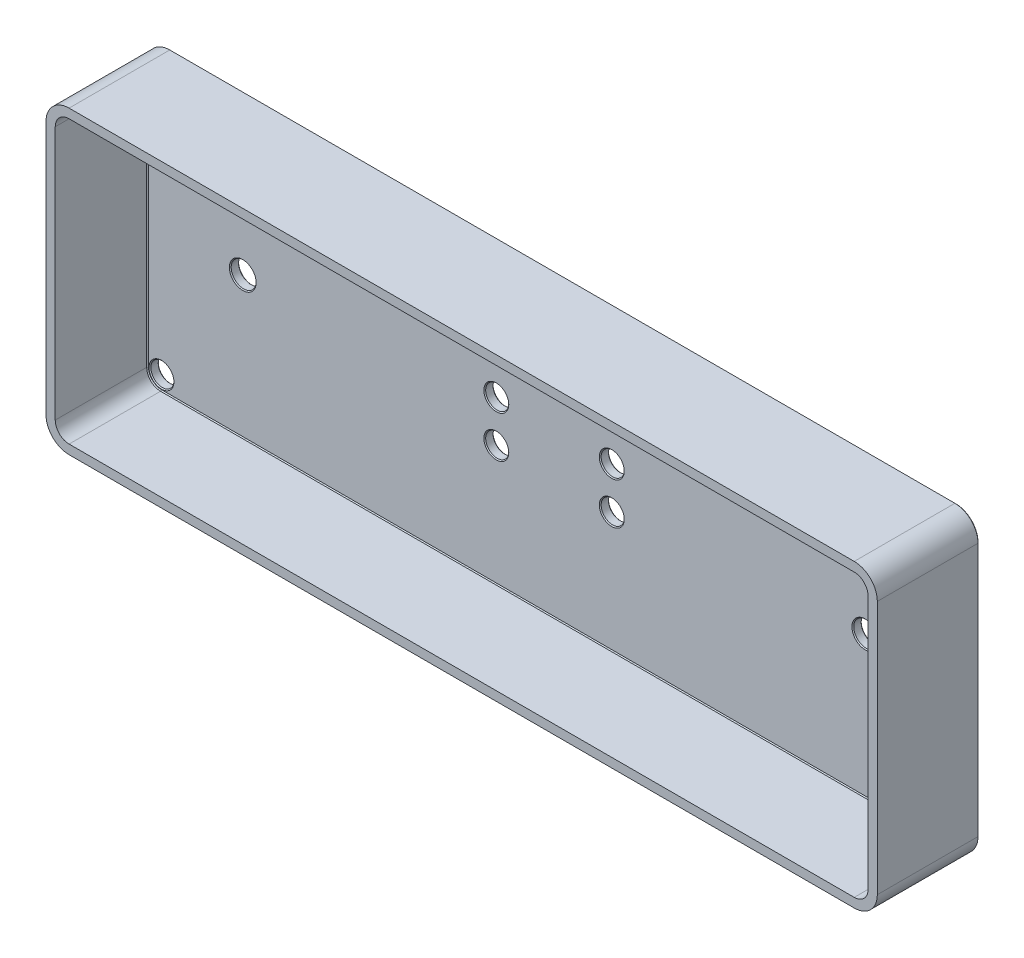
from build123d import *

# Parameters (mm, degrees)
SKETCH3_R           = 3.175
SKETCH3_R_2         = 3.429
BOSS_EXTRUDE1_DEPTH = 27.94
CUT_EXTRUDE1_DEPTH  = 25.4
CHAMFER1_SIZE       = 0.254
CHAMFER2_SIZE       = 0.254


with BuildPart() as part:
    # Sketch3 → Boss-Extrude1 (new body)
    with BuildSketch(Plane.XY):
        with BuildLine():
            Line((107.95, -41.275), (-107.95, -41.275))
            ThreePointArc((-107.95, -41.275), (-112.440128061, -39.415128061), (-114.3, -34.925))
            Line((-114.3, -34.925), (-114.3, 34.925))
            ThreePointArc((-114.3, 34.925), (-112.440128061, 39.415128061), (-107.95, 41.275))
            Line((-107.95, 41.275), (107.95, 41.275))
            ThreePointArc((107.95, 41.275), (112.440128061, 39.415128061), (114.3, 34.925))
            Line((114.3, 34.925), (114.3, -34.925))
            ThreePointArc((114.3, -34.925), (112.440128061, -39.415128061), (107.95, -41.275))
        make_face()
        with Locations((-107.95, 34.925)):
            Circle(SKETCH3_R, mode=Mode.SUBTRACT)
        with Locations((-107.95, -34.925)):
            Circle(SKETCH3_R, mode=Mode.SUBTRACT)
        with Locations((107.95, -34.925)):
            Circle(SKETCH3_R, mode=Mode.SUBTRACT)
        with Locations((107.95, 34.925)):
            Circle(SKETCH3_R, mode=Mode.SUBTRACT)
        with Locations((-85.598, 0)):
            Circle(SKETCH3_R_2, mode=Mode.SUBTRACT)
        with Locations((85.598, 0)):
            Circle(SKETCH3_R_2, mode=Mode.SUBTRACT)
        with Locations((-15.875, 5.732638889)):
            Circle(SKETCH3_R, mode=Mode.SUBTRACT)
        with Locations((15.875, 5.732638889)):
            Circle(SKETCH3_R, mode=Mode.SUBTRACT)
        with Locations((15.875, -5.732638889)):
            Circle(SKETCH3_R, mode=Mode.SUBTRACT)
        with Locations((-15.875, -5.732638889)):
            Circle(SKETCH3_R, mode=Mode.SUBTRACT)
    extrude(amount=BOSS_EXTRUDE1_DEPTH)

    # Sketch4 → Cut-Extrude1 (cut)
    with BuildSketch(Plane.XY.offset(27.94)):
        with BuildLine():
            Line((107.95, 38.735), (-107.95, 38.735))
            ThreePointArc((-107.95, 38.735), (-110.644076836, 37.619076836), (-111.76, 34.925))
            Line((-111.76, 34.925), (-111.76, -34.925))
            ThreePointArc((-111.76, -34.925), (-110.644076836, -37.619076836), (-107.95, -38.735))
            Line((-107.95, -38.735), (107.95, -38.735))
            ThreePointArc((107.95, -38.735), (110.644076836, -37.619076836), (111.76, -34.925))
            Line((111.76, -34.925), (111.76, 34.925))
            ThreePointArc((111.76, 34.925), (110.644076836, 37.619076836), (107.95, 38.735))
        make_face()
    extrude(amount=-CUT_EXTRUDE1_DEPTH, mode=Mode.SUBTRACT)

    # Chamfer1
    chamfer1_edges = [part.edges().sort_by_distance(p)[0] for p in [
        (0, 41.275, 0),
        (112.440128061, 39.415128061, 0),
        (-89.027, 0, 0),
        (82.169, 0, 0),
        (-111.125, 34.925, 0),
        (-111.125, -34.925, 0),
        (104.775, -34.925, 0),
        (104.775, 34.925, 0),
        (-19.05, 5.732638889, 0),
        (12.7, 5.732638889, 0),
        (12.7, -5.732638889, 0),
        (-19.05, -5.732638889, 0),
        (114.3, 0, 0),
        (112.440128061, -39.415128061, 0),
        (0, -41.275, 0),
        (-112.440128061, -39.415128061, 0),
        (-114.3, 0, 0),
        (-112.440128061, 39.415128061, 0),
    ]]
    chamfer(chamfer1_edges, length=CHAMFER1_SIZE)

    # Chamfer2
    chamfer2_edges = [part.edges().sort_by_distance(p)[0] for p in [
        (111.76, 0, 2.54),
        (110.644076836, -37.619076836, 2.54),
        (0, -38.735, 2.54),
        (-110.644076836, -37.619076836, 2.54),
        (-111.76, 0, 2.54),
        (-110.644076836, 37.619076836, 2.54),
        (0, 38.735, 2.54),
        (110.644076836, 37.619076836, 2.54),
        (-89.027, 0, 2.54),
        (82.169, 0, 2.54),
        (-111.125, 34.925, 2.54),
        (-111.125, -34.925, 2.54),
        (104.775, -34.925, 2.54),
        (104.775, 34.925, 2.54),
        (-19.05, 5.732638889, 2.54),
        (12.7, 5.732638889, 2.54),
        (12.7, -5.732638889, 2.54),
        (-19.05, -5.732638889, 2.54),
    ]]
    chamfer(chamfer2_edges, length=CHAMFER2_SIZE)


solid = part.part
